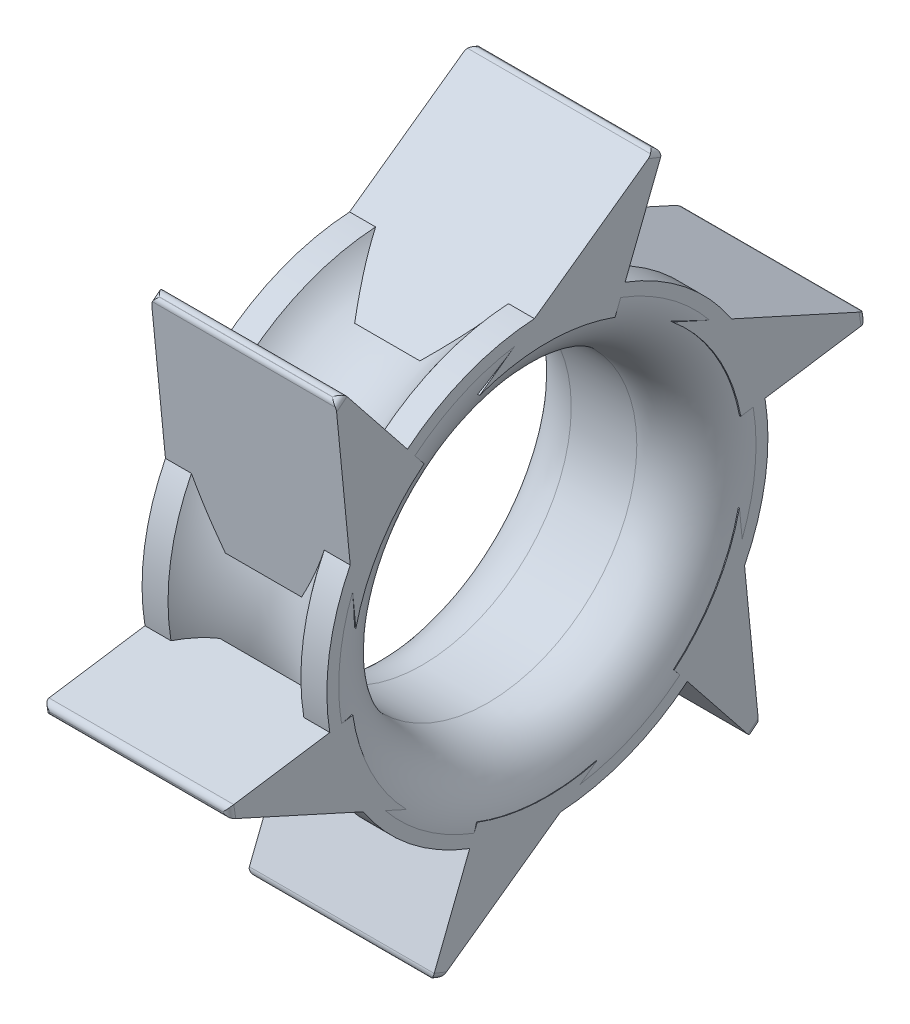
from build123d import *

# Parameters (mm, degrees)
FILLET1_R           = 10
BOSS_EXTRUDE1_DEPTH = 15.5
FILLET9_R           = 1


with BuildPart() as part:
    # Sketch1 → Revolve1 (revolve)
    with BuildSketch(Plane.XY, mode=Mode.PRIVATE) as revolve1_sk:
        with BuildLine():
            Line((11.143538165, 37), (15.5, 37))
            Line((15.5, 37), (15.5, 25))
            Line((15.5, 25), (-15.5, 25))
            Line((-15.5, 25), (-15.5, 37))
            Line((-15.5, 37), (-11.143538165, 37))
            ThreePointArc((-11.143538165, 37), (0, 31.282185202), (11.143538165, 37))
        make_face()
    revolve(revolve1_sk.sketch.rotate(Axis((-44.186757323, 0, 0), (1, 0, 0)), 90), axis=Axis((-44.186757323, 0, 0), (1, 0, 0)))

    # Fillet1
    fillet1_edges = [part.edges().sort_by_distance(p)[0] for p in [
        (15.5, 0, -25),
        (-15.5, 0, -25),
    ]]
    fillet(fillet1_edges, radius=FILLET1_R)

    # Sketch2 → Boss-Extrude1 (add, symmetric)
    with BuildSketch(Plane(origin=(0, 0, 0), x_dir=(0, 0, -1), z_dir=(1, 0, 0))):
        with BuildLine():
            ThreePointArc((-32.130718018, 6.90801174), (-27.928790167, 16.961490703), (-20.681915403, 25.098532124))
            Line((-20.681915403, 25.098532124), (-34.24897819, 42.126782047))
            Line((-34.24897819, 42.126782047), (-35.479782519, 41.14330945))
            Line((-35.479782519, 41.14330945), (-32.130718018, 6.90801174))
        make_face()
        with BuildLine():
            Line((11.358422209, 30.367232332), (19.358374338, 50.72387619))
            Line((19.358374338, 50.72387619), (17.89125992, 51.298047707))
            Line((17.89125992, 51.298047707), (-11.358422209, 30.367232332))
            ThreePointArc((-11.358422209, 30.367232332), (0, 32.383587535), (11.358422209, 30.367232332))
        make_face()
        with BuildLine():
            Line((53.371042439, 10.154738257), (20.97785951, 24.85768046))
            ThreePointArc((20.97785951, 24.85768046), (28.424525318, 16.148024908), (32.443779834, 5.416924097))
            Line((32.443779834, 5.416924097), (53.607352528, 8.597094142))
            Line((53.607352528, 8.597094142), (53.371042439, 10.154738257))
        make_face()
        with BuildLine():
            Line((35.479782519, -41.14330945), (32.215123846, -7.770837359))
            ThreePointArc((32.215123846, -7.770837359), (28.230259049, -17.705955291), (21.274976953, -25.842893703))
            Line((21.274976953, -25.842893703), (34.24897819, -42.126782047))
            Line((34.24897819, -42.126782047), (35.479782519, -41.14330945))
        make_face()
        with BuildLine():
            Line((-17.89125992, -51.298047707), (8.300524441, -32.55543709))
            ThreePointArc((8.300524441, -32.55543709), (-1.827019152, -33.565797907), (-11.780772845, -31.441943948))
            Line((-11.780772845, -31.441943948), (-19.358374338, -50.72387619))
            Line((-19.358374338, -50.72387619), (-17.89125992, -51.298047707))
        make_face()
        with BuildLine():
            ThreePointArc((-23.626099455, -23.655670799), (-29.571670955, -15.262786656), (-32.644518238, -5.447088298))
            Line((-32.644518238, -5.447088298), (-53.607352528, -8.597094142))
            Line((-53.607352528, -8.597094142), (-53.371042439, -10.154738257))
            Line((-53.371042439, -10.154738257), (-23.626099455, -23.655670799))
        make_face()
    extrude(amount=BOSS_EXTRUDE1_DEPTH, both=True)

    # Fillet9
    fillet9_edges = [part.edges().sort_by_distance(p)[0] for p in [
        (-15.5, 9.3759162, -53.489197483),
        (0, 10.154738257, -53.371042439),
        (15.5, 9.3759162, -53.489197483),
        (0, 8.597094142, -53.607352528),
        (-15.5, -41.635045749, -34.864380354),
        (0, -41.14330945, -35.479782519),
        (15.5, -41.635045749, -34.864380354),
        (0, -42.126782047, -34.24897819),
        (-15.5, -51.010961948, 18.624817129),
        (0, -51.298047707, 17.89125992),
        (15.5, -51.010961948, 18.624817129),
        (0, -50.72387619, 19.358374338),
        (-15.5, -9.3759162, 53.489197483),
        (0, -10.154738257, 53.371042439),
        (15.5, -9.3759162, 53.489197483),
        (0, -8.597094142, 53.607352528),
        (-15.5, 41.635045749, 34.864380354),
        (0, 41.14330945, 35.479782519),
        (15.5, 41.635045749, 34.864380354),
        (0, 42.126782047, 34.24897819),
        (-15.5, 51.010961949, -18.624817129),
        (0, 51.298047707, -17.89125992),
        (15.5, 51.010961949, -18.624817129),
        (0, 50.72387619, -19.358374338),
    ]]
    fillet(fillet9_edges, radius=FILLET9_R)


solid = part.part
